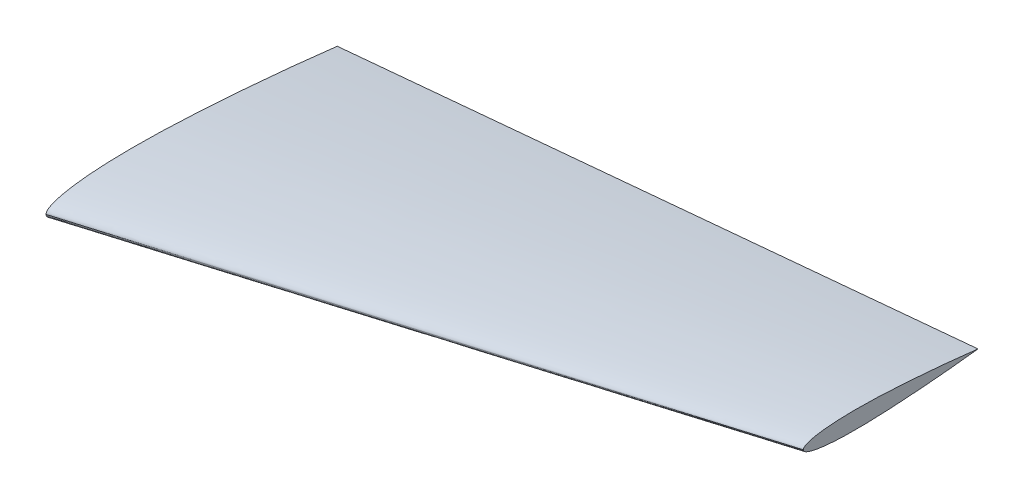
from build123d import *


with BuildPart() as part:
    # Sketch7 → Loft2 section 0
    with BuildSketch(Plane(origin=(500, 0, 0), x_dir=(0, 0, -1), z_dir=(1, 0, 0))):
        with BuildLine():
            add(Edge.make_bspline(
                [(-100, 0), (-99.999937168, 0.117458016), (-99.976690854, 0.362354041), (-99.855735538, 0.757950568), (-99.476892342, 1.343884103), (-98.865894277, 1.905141517), (-97.945661581, 2.509663886), (-96.476265497, 3.220015573), (-94.04432364, 4.090753893), (-89.704028605, 5.166773097), (-82.776680638, 6.26979221), (-73.484627866, 7.090651632), (-62.495358508, 7.519503098), (-50.569404353, 7.537422113), (-38.776783522, 7.262493565), (-26.789856001, 6.732528635), (-15.139317368, 6.064399479), (-2.963497284, 5.188719038), (8.325315593, 4.298475849), (21.050500588, 3.123024292), (31.373514283, 2.12842443), (42.077742318, 0.935284249), (47.319666318, 0.324655417), (50, 0)],
                knots=[0, 0, 0, 0, 0, 0.0027914, 0.005882719, 0.009734657, 0.016522403, 0.022438151, 0.032158027, 0.04863424, 0.078248652, 0.129036717, 0.199997011, 0.270957307, 0.341917602, 0.412877898, 0.483838194, 0.554798491, 0.625758787, 0.696719083, 0.767679379, 0.838639675, 0.909599973, 0.909599973, 0.909599973, 0.909599973, 0.909599973], degree=4))
            add(Edge.make_bspline(
                [(-100, 0), (-99.999937169, -0.117458016), (-99.976690854, -0.362354041), (-99.855735538, -0.757950568), (-99.476892342, -1.343884103), (-98.865894277, -1.905141517), (-97.945661581, -2.509663886), (-96.476265497, -3.220015573), (-94.04432364, -4.090753893), (-89.704028605, -5.166773097), (-82.776680638, -6.26979221), (-73.484627866, -7.090651632), (-62.495358508, -7.519503098), (-50.569404353, -7.537422113), (-38.776783522, -7.262493565), (-26.789856001, -6.732528635), (-15.139317368, -6.064399479), (-2.963497285, -5.188719038), (8.325315593, -4.298475849), (21.050500588, -3.123024292), (31.373514283, -2.12842443), (42.077742318, -0.935284249), (47.319666318, -0.324655417), (50, 0)],
                knots=[0, 0, 0, 0, 0, 0.0027914, 0.005882719, 0.009734657, 0.016522403, 0.022438151, 0.032158027, 0.04863424, 0.078248652, 0.129036717, 0.199997011, 0.270957307, 0.341917602, 0.412877898, 0.483838194, 0.554798491, 0.625758787, 0.696719083, 0.767679379, 0.838639675, 0.909599973, 0.909599973, 0.909599973, 0.909599973, 0.909599973], degree=4))
        make_face()
    # Sketch4 → Loft2 section 1
    with BuildSketch(Plane(origin=(0, 0, 0), x_dir=(0, 0, -1), z_dir=(1, 0, 0))):
        with BuildLine():
            add(Edge.make_bspline(
                [(-250, 0), (-249.999895281, 0.195763361), (-249.961151424, 0.603923402), (-249.75955923, 1.263250946), (-249.128153903, 2.239806839), (-248.109823795, 3.175235862), (-246.576102635, 4.182773144), (-244.127109162, 5.366692622), (-240.073872734, 6.817923154), (-232.840047676, 8.611288496), (-221.29446773, 10.449653683), (-205.80771311, 11.81775272), (-187.49226418, 12.532505163), (-167.615673922, 12.562370188), (-147.96130587, 12.104155942), (-127.983093335, 11.220881059), (-108.565528946, 10.107332464), (-88.272495474, 8.647865064), (-69.457807346, 7.164126414), (-48.249165687, 5.205040487), (-31.044142862, 3.54737405), (-13.203762803, 1.558807082), (-4.467222803, 0.541092362), (0, 0)],
                knots=[0, 0, 0, 0, 0, 0.0027914, 0.005882719, 0.009734657, 0.016522403, 0.022438151, 0.032158027, 0.04863424, 0.078248652, 0.129036717, 0.199997011, 0.270957307, 0.341917602, 0.412877898, 0.483838194, 0.554798491, 0.625758787, 0.696719083, 0.767679379, 0.838639675, 0.909599973, 0.909599973, 0.909599973, 0.909599973, 0.909599973], degree=4))
            add(Edge.make_bspline(
                [(-250, 0), (-249.999895281, -0.195763361), (-249.961151424, -0.603923402), (-249.75955923, -1.263250946), (-249.128153903, -2.239806839), (-248.109823795, -3.175235862), (-246.576102635, -4.182773144), (-244.127109162, -5.366692622), (-240.073872734, -6.817923154), (-232.840047676, -8.611288496), (-221.29446773, -10.449653683), (-205.80771311, -11.81775272), (-187.49226418, -12.532505163), (-167.615673922, -12.562370188), (-147.96130587, -12.104155942), (-127.983093335, -11.220881059), (-108.565528946, -10.107332464), (-88.272495474, -8.647865064), (-69.457807346, -7.164126414), (-48.249165687, -5.205040487), (-31.044142862, -3.54737405), (-13.203762803, -1.558807082), (-4.467222803, -0.541092362), (0, 0)],
                knots=[0, 0, 0, 0, 0, 0.0027914, 0.005882719, 0.009734657, 0.016522403, 0.022438151, 0.032158027, 0.04863424, 0.078248652, 0.129036717, 0.199997011, 0.270957307, 0.341917602, 0.412877898, 0.483838194, 0.554798491, 0.625758787, 0.696719083, 0.767679379, 0.838639675, 0.909599973, 0.909599973, 0.909599973, 0.909599973, 0.909599973], degree=4))
        make_face()
    loft()


solid = part.part
